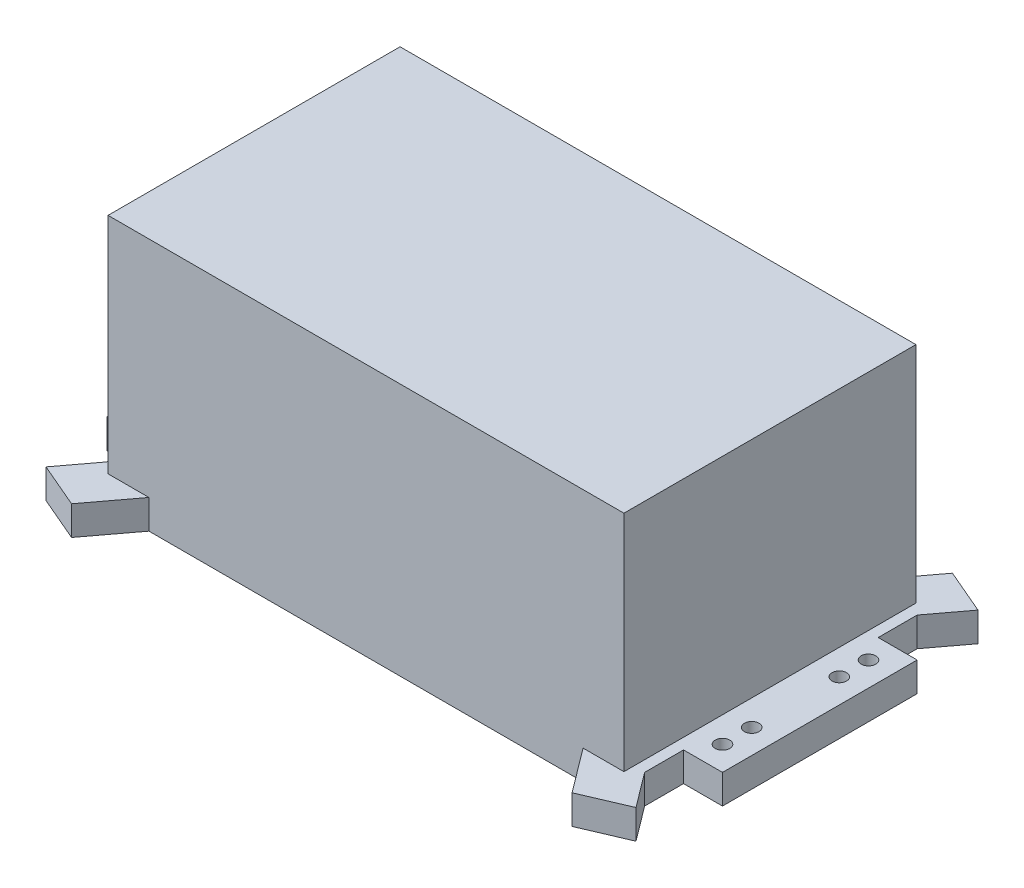
from build123d import *

# Parameters (mm, degrees)
SKETCH_1_R      = 1.5
EXTRUDE_1_DEPTH = 6
SKETCH_2_W      = 106
SKETCH_2_H      = 60
EXTRUDE_2_DEPTH = 46


with BuildPart() as part:
    # 草图1 → 凸台-拉伸1 (new body)
    with BuildSketch(Plane(origin=(0, 0, 0), x_dir=(1, 0, 0), z_dir=(0, 1, 0))):
        Polygon((44.601753779, -30), (-44.601753779, -30), (-51.423054046, -39.075905643), (-60.615391847, -35.138784137), (-55.25, -28), (-55.25, -20), (-63.25, -20), (-63.25, 20), (-55.25, 20), (-55.25, 28), (-60.615391847, 35.138784137), (-51.423054046, 39.075905643), (-44.601753779, 30), (44.601753779, 30), (51.423054046, 39.075905643), (60.615391847, 35.138784137), (55.25, 28), (55.25, 20), (63.25, 20), (63.25, -20), (55.25, -20), (55.25, -28), (60.615391847, -35.138784137), (51.423054046, -39.075905643), align=None)
        with Locations(Location((58.25, 15, 0), (0, 0, 270))):
            Circle(SKETCH_1_R, mode=Mode.SUBTRACT)
        with Locations(Location((-58.25, 15, 0), (0, 0, 270))):
            Circle(SKETCH_1_R, mode=Mode.SUBTRACT)
        with Locations(Location((58.25, 9, 0), (0, 0, 270))):
            Circle(SKETCH_1_R, mode=Mode.SUBTRACT)
        with Locations(Location((-58.25, 9, 0), (0, 0, 270))):
            Circle(SKETCH_1_R, mode=Mode.SUBTRACT)
        with Locations(Location((58.25, -9, 0), (0, 0, 90))):
            Circle(SKETCH_1_R, mode=Mode.SUBTRACT)
        with Locations(Location((58.25, -15, 0), (0, 0, 90))):
            Circle(SKETCH_1_R, mode=Mode.SUBTRACT)
        with Locations(Location((-58.25, -9, 0), (0, 0, 90))):
            Circle(SKETCH_1_R, mode=Mode.SUBTRACT)
        with Locations(Location((-58.25, -15, 0), (0, 0, 90))):
            Circle(SKETCH_1_R, mode=Mode.SUBTRACT)
    extrude(amount=EXTRUDE_1_DEPTH)

    # 草图2 → 凸台-拉伸2 (add)
    with BuildSketch(Plane(origin=(0, 6, 0), x_dir=(1, 0, 0), z_dir=(0, 1, 0))):
        Rectangle(SKETCH_2_W, SKETCH_2_H)
    extrude(amount=EXTRUDE_2_DEPTH)


solid = part.part
